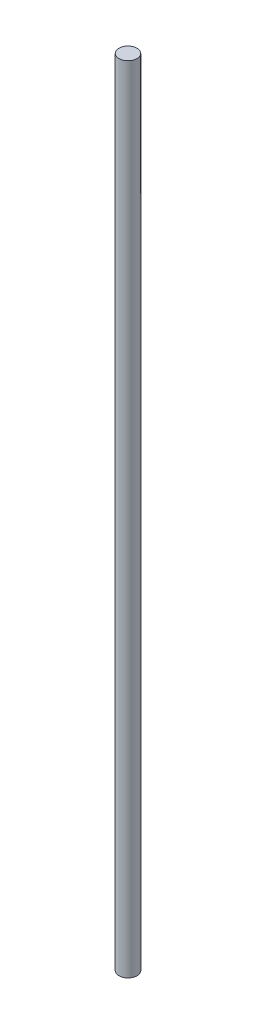
from build123d import *

# Parameters (mm, degrees)
SKETCH1_R           = 2.5
BOSS_EXTRUDE1_DEPTH = 220


with BuildPart() as part:
    # Sketch1 → Boss-Extrude1 (new body)
    with BuildSketch(Plane(origin=(0, 0, 0), x_dir=(1, 0, 0), z_dir=(0, 1, 0))):
        with Locations(Location((0, 0, 0), (0, 0, 270))):
            Circle(SKETCH1_R)
    extrude(amount=BOSS_EXTRUDE1_DEPTH)


solid = part.part
